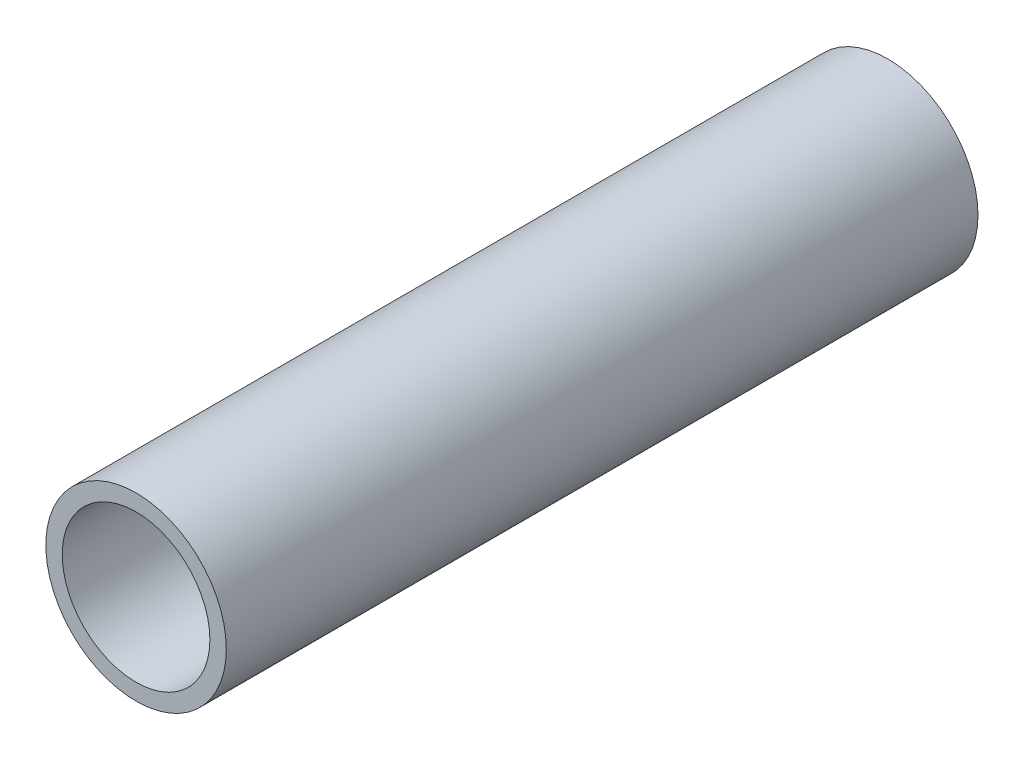
from build123d import *

# Parameters (mm, degrees)
SKETCH1_R           = 5.335
SKETCH1_R_2         = 4.365
BOSS_EXTRUDE1_DEPTH = 44.45


with BuildPart() as part:
    # Sketch1 → Boss-Extrude1 (new body)
    with BuildSketch(Plane.XY):
        Circle(SKETCH1_R)
        Circle(SKETCH1_R_2, mode=Mode.SUBTRACT)
    extrude(amount=BOSS_EXTRUDE1_DEPTH)


solid = part.part
